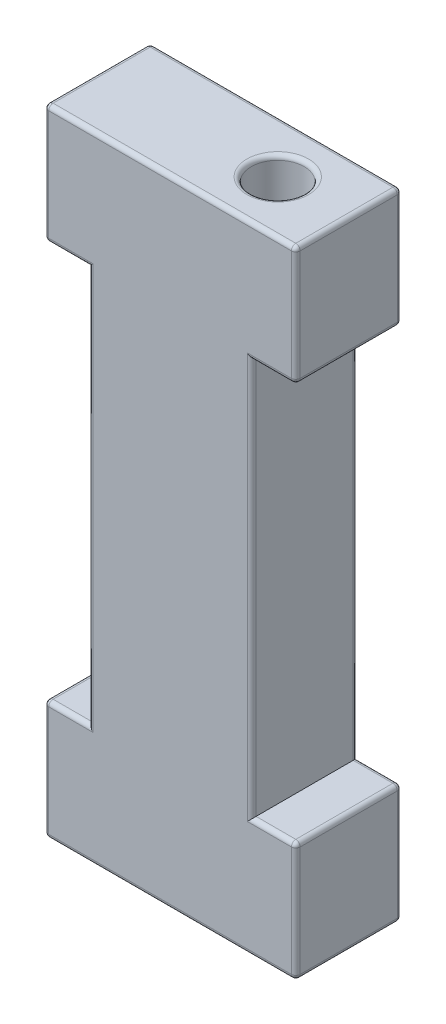
from build123d import *

# Parameters (mm, degrees)
ESBO_O1_W                = 28.5
ESBO_O1_H                = 12
ESBO_O1_R                = 3
RESSALTO_EXTRUS_O1_DEPTH = 36
ESBO_O2_W                = 10
ESBO_O2_H                = 45
CORTE_EXTRUS_O1_DEPTH    = 10
FILETE1_R                = 0.5


with BuildPart() as part:
    # Esboço1 → Ressalto-extrusão1 (new, symmetric)
    with BuildSketch(Plane(origin=(0, 0, 0), x_dir=(1, 0, 0), z_dir=(0, 1, 0))):
        Rectangle(ESBO_O1_W, ESBO_O1_H)
        with Locations(Location((6.205688, 0, 0), (0, 0, 270))):
            Circle(ESBO_O1_R, mode=Mode.SUBTRACT)
    extrude(amount=RESSALTO_EXTRUS_O1_DEPTH, both=True)

    # Esboço2 → Corte-extrusão1 (cut, symmetric)
    with BuildSketch(Plane.XY):
        with Locations((-14.25, 0)):
            Rectangle(ESBO_O2_W, ESBO_O2_H)
        with Locations((14.25, 0)):
            Rectangle(ESBO_O2_W, ESBO_O2_H)
    extrude(amount=CORTE_EXTRUS_O1_DEPTH, both=True, mode=Mode.SUBTRACT)

    # Filete1
    filete1_edges = [part.edges().sort_by_distance(p)[0] for p in [
        (-14.25, 36, 0),
        (6.205688, -36, -3),
        (6.205688, 36, -3),
        (0, 36, 6),
        (-14.25, -29.25, 6),
        (-11.75, 22.5, 6),
        (-9.25, 0, 6),
        (-11.75, -22.5, 6),
        (-14.25, -29.25, -6),
        (-9.25, 0, -6),
        (-14.25, -22.5, 0),
        (-11.75, -22.5, -6),
        (-11.75, 22.5, -6),
        (-14.25, 22.5, 0),
        (14.25, -29.25, 6),
        (11.75, 22.5, 6),
        (9.25, 0, 6),
        (11.75, -22.5, 6),
        (14.25, -29.25, -6),
        (11.75, -22.5, -6),
        (14.25, 36, 0),
        (14.25, -22.5, 0),
        (9.25, 0, -6),
        (14.25, 22.5, 0),
        (11.75, 22.5, -6),
        (0, -36, 6),
        (-14.25, -36, 0),
        (0, -36, -6),
        (14.25, -36, 0),
        (0, 36, -6),
        (14.25, 29.25, 6),
        (-14.25, 29.25, 6),
        (-14.25, 29.25, -6),
        (14.25, 29.25, -6),
    ]]
    fillet(filete1_edges, radius=FILETE1_R)


solid = part.part
